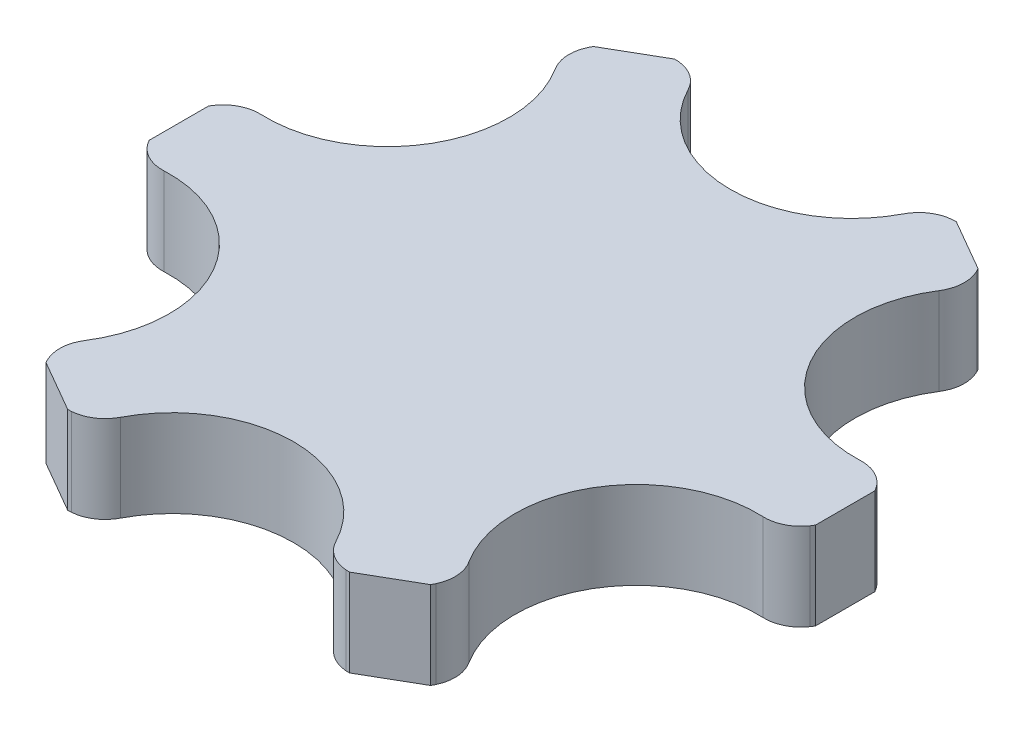
from build123d import *

# Parameters (mm, degrees)
BOSS_EXTRUDE1_DEPTH = 36
CIRPATTERN1_COUNT   = 6
CUT_EXTRUDE3_DEPTH  = 36
CUT_EXTRUDE9_DEPTH  = 36


with BuildPart() as part:
    # Sketch2 → Boss-Extrude1 (new body)
    with BuildSketch(Plane(origin=(0, 0, 0), x_dir=(1, 0, 0), z_dir=(0, 1, 0))):
        Polygon((0, 125), (-58.08143708, 125), (-79.212456933, 112.8), (-108.253175473, 62.5), (0, 0), align=None)
    boss_extrude1 = extrude(amount=BOSS_EXTRUDE1_DEPTH)

    # CirPattern1: Boss-Extrude1 ×6 about axis
    cirpattern1_axis = Axis((0, 36, 0), (0, -1, 0))
    for i in range(1, CIRPATTERN1_COUNT):
        add(boss_extrude1.rotate(cirpattern1_axis, i * 360 / CIRPATTERN1_COUNT))

    # Sketch4 → Cut-Extrude3 (cut)
    with BuildSketch(Plane(origin=(0, 36, 0), x_dir=(1, 0, 0), z_dir=(0, 1, 0))):
        with BuildLine():
            Line((79.212456933, -112.8), (137.293894013, -12.2))
            ThreePointArc((137.293894013, -12.2), (125.5592118, -23.716902798), (109.56410095, -27.524558982))
            ThreePointArc((109.56410095, -27.524558982), (77.942286341, -45), (78.619017782, -81.123015275))
            ThreePointArc((78.619017782, -81.123015275), (83.319046223, -96.879015699), (79.212456933, -112.8))
        make_face()
        with BuildLine():
            Line((137.293894013, 12.2), (79.212456933, 112.8))
            ThreePointArc((79.212456933, 112.8), (83.319046223, 96.879015699), (78.619017782, 81.123015275))
            ThreePointArc((78.619017782, 81.123015275), (77.942286341, 45), (109.56410095, 27.524558982))
            ThreePointArc((109.56410095, 27.524558982), (125.5592118, 23.716902798), (137.293894013, 12.2))
        make_face()
        with BuildLine():
            Line((58.08143708, 125), (-58.08143708, 125))
            ThreePointArc((-58.08143708, 125), (-42.240165578, 120.595918497), (-30.945083169, 108.647574257))
            ThreePointArc((-30.945083169, 108.647574257), (0, 90), (30.945083169, 108.647574257))
            ThreePointArc((30.945083169, 108.647574257), (42.240165578, 120.595918497), (58.08143708, 125))
        make_face()
        with BuildLine():
            Line((-79.212456933, 112.8), (-137.293894013, 12.2))
            ThreePointArc((-137.293894013, 12.2), (-125.5592118, 23.716902798), (-109.56410095, 27.524558982))
            ThreePointArc((-109.56410095, 27.524558982), (-77.942286341, 45), (-78.619017782, 81.123015275))
            ThreePointArc((-78.619017782, 81.123015275), (-83.319046223, 96.879015699), (-79.212456933, 112.8))
        make_face()
        with BuildLine():
            Line((-137.293894013, -12.2), (-79.212456933, -112.8))
            ThreePointArc((-79.212456933, -112.8), (-83.319046223, -96.879015699), (-78.619017782, -81.123015275))
            ThreePointArc((-78.619017782, -81.123015275), (-77.942286341, -45), (-109.56410095, -27.524558982))
            ThreePointArc((-109.56410095, -27.524558982), (-125.5592118, -23.716902798), (-137.293894013, -12.2))
        make_face()
        with BuildLine():
            Line((-58.08143708, -125), (58.08143708, -125))
            ThreePointArc((58.08143708, -125), (42.240165578, -120.595918497), (30.945083169, -108.647574257))
            ThreePointArc((30.945083169, -108.647574257), (0, -90), (-30.945083169, -108.647574257))
            ThreePointArc((-30.945083169, -108.647574257), (-42.240165578, -120.595918497), (-58.08143708, -125))
        make_face()
    extrude(amount=-CUT_EXTRUDE3_DEPTH, mode=Mode.SUBTRACT)

    # Sketch9 → Cut-Extrude9 (cut)
    with BuildSketch(Plane(origin=(0, 36, 0), x_dir=(1, 0, 0), z_dir=(0, 1, 0))):
        with BuildLine():
            Line((57.250180902, 125), (-57.250180902, 125))
            ThreePointArc((-57.250180902, 125), (-49.705136426, 122.71904735), (-44.358314608, 116.927507176))
            ThreePointArc((-44.358314608, 116.927507176), (0, 90), (44.358314608, 116.927507176))
            ThreePointArc((44.358314608, 116.927507176), (49.705136426, 122.71904735), (57.250180902, 125))
        make_face()
        with BuildLine():
            Line((136.878265924, 12.919888968), (79.628085022, 112.080111032))
            ThreePointArc((79.628085022, 112.080111032), (81.425244321, 104.405434518), (79.083034312, 96.879180908))
            ThreePointArc((79.083034312, 96.879180908), (77.942286341, 45), (123.44134892, 20.048326268))
            ThreePointArc((123.44134892, 20.048326268), (131.130380747, 18.313612832), (136.878265924, 12.919888968))
        make_face()
        with BuildLine():
            Line((79.628085022, -112.080111032), (136.878265924, -12.919888968))
            ThreePointArc((136.878265924, -12.919888968), (131.130380747, -18.313612832), (123.44134892, -20.048326268))
            ThreePointArc((123.44134892, -20.048326268), (77.942286341, -45), (79.083034312, -96.879180908))
            ThreePointArc((79.083034312, -96.879180908), (81.425244321, -104.405434518), (79.628085022, -112.080111032))
        make_face()
        with BuildLine():
            Line((-57.250180902, -125), (57.250180902, -125))
            ThreePointArc((57.250180902, -125), (49.705136426, -122.71904735), (44.358314608, -116.927507176))
            ThreePointArc((44.358314608, -116.927507176), (0, -90), (-44.358314608, -116.927507176))
            ThreePointArc((-44.358314608, -116.927507176), (-49.705136426, -122.71904735), (-57.250180902, -125))
        make_face()
        with BuildLine():
            Line((-136.878265924, -12.919888968), (-79.628085022, -112.080111032))
            ThreePointArc((-79.628085022, -112.080111032), (-81.425244321, -104.405434518), (-79.083034312, -96.879180908))
            ThreePointArc((-79.083034312, -96.879180908), (-77.942286341, -45), (-123.44134892, -20.048326268))
            ThreePointArc((-123.44134892, -20.048326268), (-131.130380747, -18.313612832), (-136.878265924, -12.919888968))
        make_face()
        with BuildLine():
            Line((-79.628085022, 112.080111032), (-136.878265924, 12.919888968))
            ThreePointArc((-136.878265924, 12.919888968), (-131.130380747, 18.313612832), (-123.44134892, 20.048326268))
            ThreePointArc((-123.44134892, 20.048326268), (-77.942286341, 45), (-79.083034312, 96.879180908))
            ThreePointArc((-79.083034312, 96.879180908), (-81.425244321, 104.405434518), (-79.628085022, 112.080111032))
        make_face()
    extrude(amount=-CUT_EXTRUDE9_DEPTH, mode=Mode.SUBTRACT)


solid = part.part
